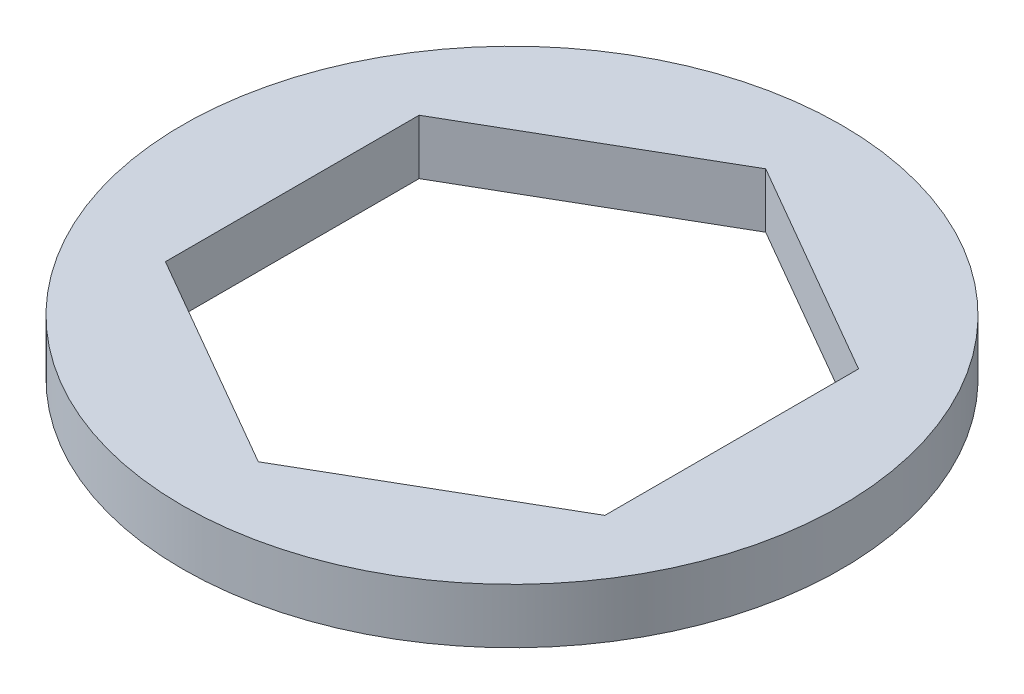
from build123d import *

# Parameters (mm, degrees)
SKETCH1_R           = 9.525
BOSS_EXTRUDE1_DEPTH = 1.5875


with BuildPart() as part:
    # Sketch1 → Boss-Extrude1 (new body)
    with BuildSketch(Plane(origin=(0, 0, 0), x_dir=(1, 0, 0), z_dir=(0, 1, 0))):
        with Locations(Location((0, 0, 0), (0, 0, 270))):
            Circle(SKETCH1_R)
        Polygon((6.35, 3.666174209), (0, 7.332348419), (-6.35, 3.666174209), (-6.35, -3.666174209), (0, -7.332348419), (6.35, -3.666174209), align=None, mode=Mode.SUBTRACT)
    extrude(amount=BOSS_EXTRUDE1_DEPTH)


solid = part.part
